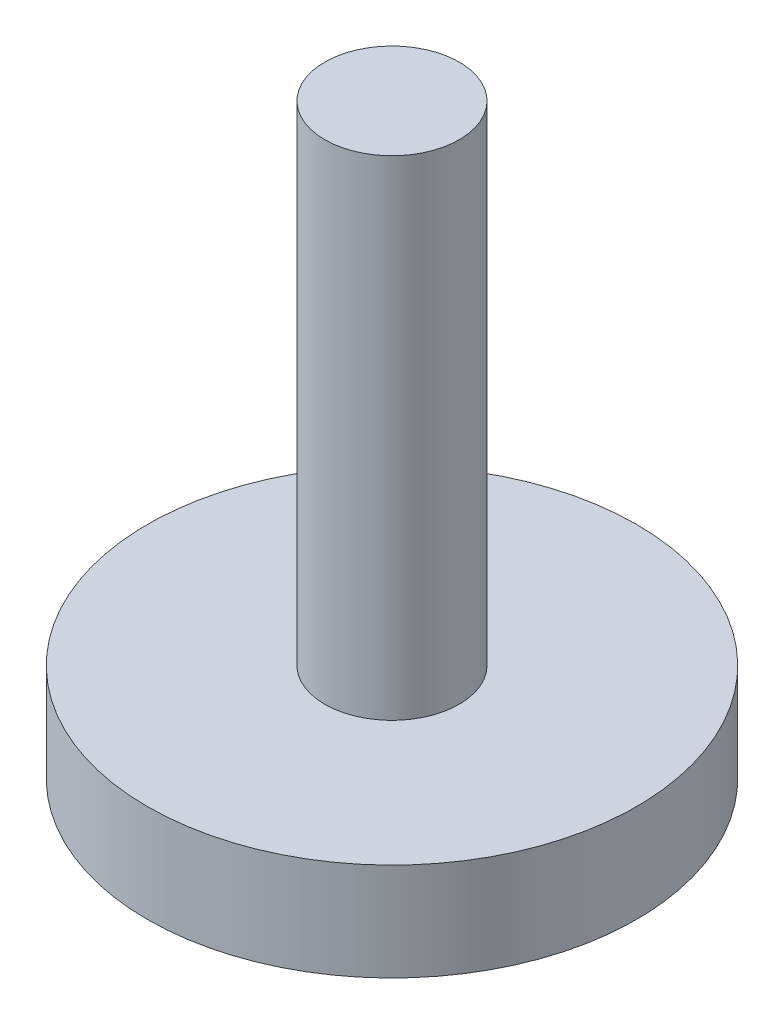
from build123d import *

# Parameters (mm, degrees)
SKETCH_1_R      = 7.5
EXTRUDE_1_DEPTH = 3
SKETCH_2_R      = 2.0625
EXTRUDE_2_DEPTH = 15


with BuildPart() as part:
    # 스케치1 → 보스-돌출1 (new body)
    with BuildSketch(Plane(origin=(0, 0, 0), x_dir=(1, 0, 0), z_dir=(0, 1, 0))):
        with Locations(Location((0, 0, 0), (0, 0, 270))):
            Circle(SKETCH_1_R)
    extrude(amount=EXTRUDE_1_DEPTH)

    # 스케치2 → 보스-돌출2 (add)
    with BuildSketch(Plane(origin=(0, 3, 0), x_dir=(1, 0, 0), z_dir=(0, 1, 0))):
        with Locations(Location((0, 0, 0), (0, 0, 270))):
            Circle(SKETCH_2_R)
    extrude(amount=EXTRUDE_2_DEPTH)


solid = part.part
